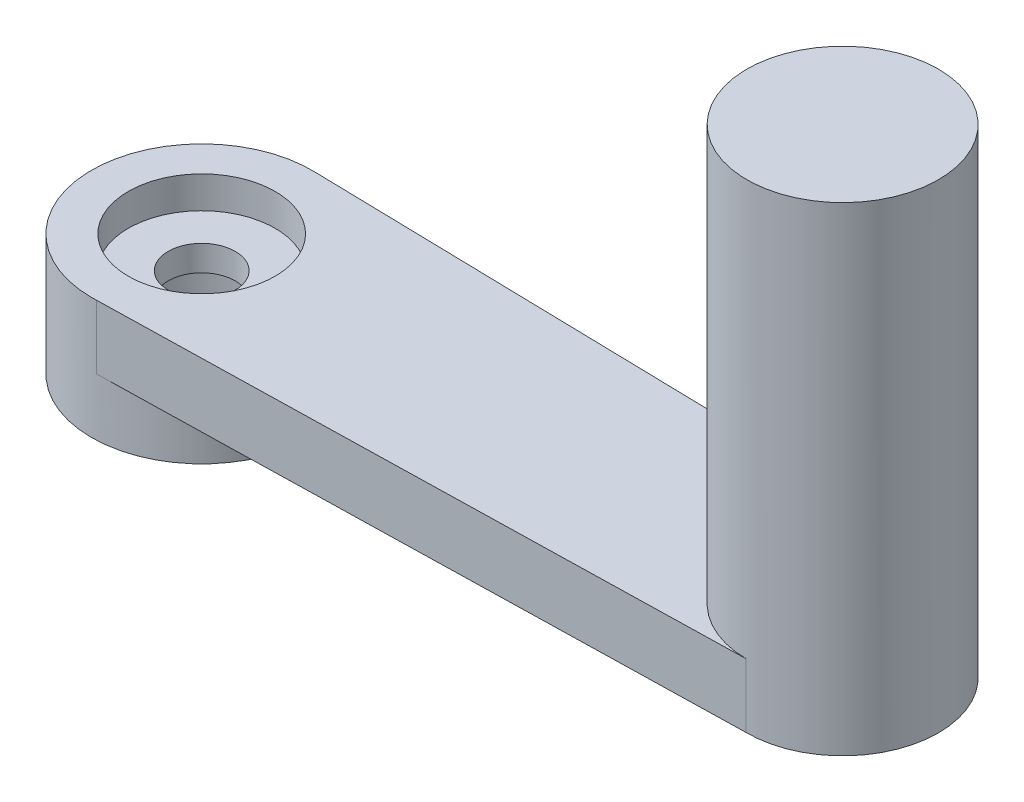
from build123d import *

# Parameters (mm, degrees)
ESBO_O1_R                = 3.45
RESSALTO_EXTRUS_O1_DEPTH = 1.4
ESBO_O2_R                = 3.45
RESSALTO_EXTRUS_O2_DEPTH = 2.4
FURO1_D                  = 4.95
FURO1_DEPTH              = 2
FURO2_D                  = 4.6
FURO2_DEPTH              = 1
FURO3_D                  = 2.1
BOSS_EXTRUDE1_DEPTH      = 2
SKETCH3_R                = 3
BOSS_EXTRUDE2_DEPTH      = 15


with BuildPart() as part:
    # Esboço1 → Ressalto-extrusão1 (new body)
    with BuildSketch(Plane(origin=(0, 0, 0), x_dir=(1, 0, 0), z_dir=(0, 1, 0))):
        with Locations(Location((0, 0, 0), (0, 0, 270))):
            Circle(ESBO_O1_R)
    extrude(amount=-RESSALTO_EXTRUS_O1_DEPTH)

    # Esboço2 → Ressalto-extrusão2 (add)
    with BuildSketch(Plane.XZ.offset(1.4)):
        with Locations(Location((0, 0, 0), (0, 0, 90))):
            Circle(ESBO_O2_R)
    extrude(amount=RESSALTO_EXTRUS_O2_DEPTH)

    # Furo1
    with Locations(Plane(origin=(0, -3.8, 0), x_dir=(-1, 0, 0), z_dir=(0, -1, 0))):
        with Locations((0, 0)):
            Hole(FURO1_D / 2, depth=FURO1_DEPTH)

    # Furo2
    with Locations(Plane(origin=(0, 0, 0), x_dir=(1, 0, 0), z_dir=(0, 1, 0))):
        with Locations((0, 0)):
            Hole(FURO2_D / 2, depth=FURO2_DEPTH)

    # Furo3 (through all)
    with Locations(Plane(origin=(0, 0, 0), x_dir=(1, 0, 0), z_dir=(0, 1, 0))):
        with Locations((0, 0)):
            Hole(FURO3_D / 2)

    # Sketch2 → Boss-Extrude1 (add)
    with BuildSketch(Plane(origin=(0, 0, 0), x_dir=(1, 0, 0), z_dir=(0, 1, 0))):
        with BuildLine():
            Line((20.067369497, 2.999243463), (0.154910769, 3.446520369))
            ThreePointArc((0.154910769, 3.446520369), (2.493686243, 2.384120157), (3.45, 0))
            ThreePointArc((3.45, 0), (2.493686243, -2.384120157), (0.154910769, -3.446520369))
            Line((0.154910769, -3.446520369), (20.067369497, -2.999243463))
            ThreePointArc((20.067369497, -2.999243463), (23, 0), (20.067369497, 2.999243463))
        make_face()
    extrude(amount=-BOSS_EXTRUDE1_DEPTH)

    # Sketch3 → Boss-Extrude2 (add)
    with BuildSketch(Plane.XZ.offset(2)):
        with Locations(Location((20.067369497, 0, 0), (0, 0, 270))):
            Circle(SKETCH3_R)
    extrude(amount=-BOSS_EXTRUDE2_DEPTH)


solid = part.part
